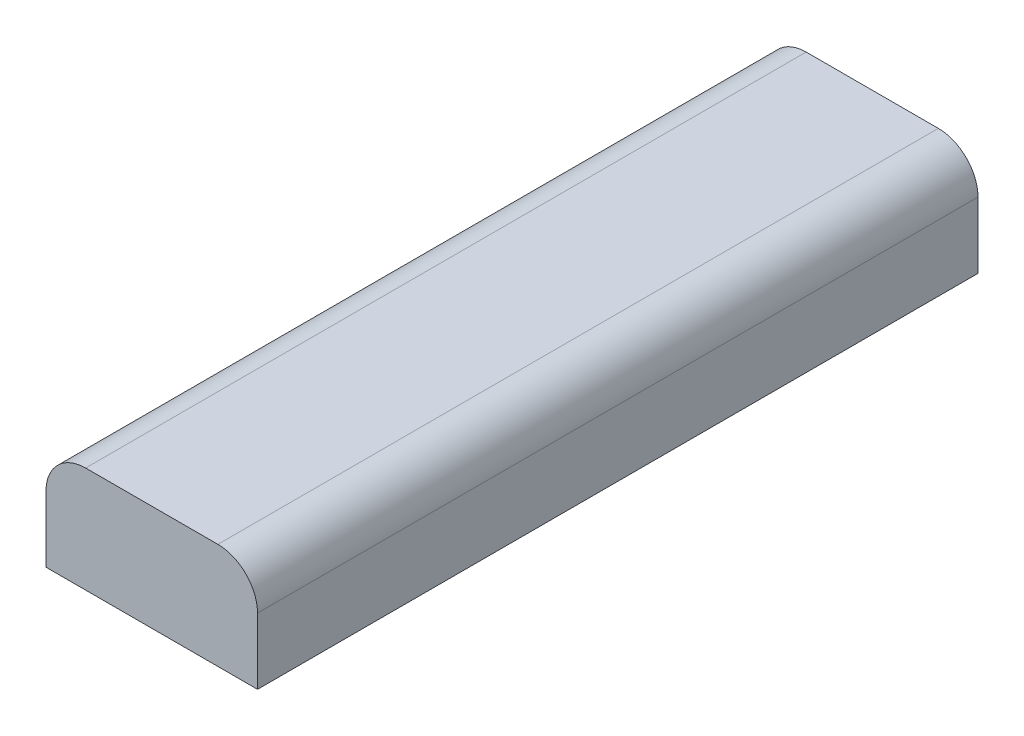
from build123d import *

# Parameters (mm, degrees)
SKETCH_1_W      = 32
SKETCH_1_H      = 16
EXTRUDE_1_DEPTH = 109
FILLET_1_R      = 6


with BuildPart() as part:
    # Эскиз1 → Бобышка-Вытянуть1 (new body)
    with BuildSketch(Plane.XY):
        with Locations((16, 8)):
            Rectangle(SKETCH_1_W, SKETCH_1_H)
    extrude(amount=EXTRUDE_1_DEPTH)

    # Скругление1
    fillet_1_edges = [part.edges().sort_by_distance(p)[0] for p in [
        (0, 16, 54.5),
        (32, 16, 54.5),
    ]]
    fillet(fillet_1_edges, radius=FILLET_1_R)


solid = part.part
